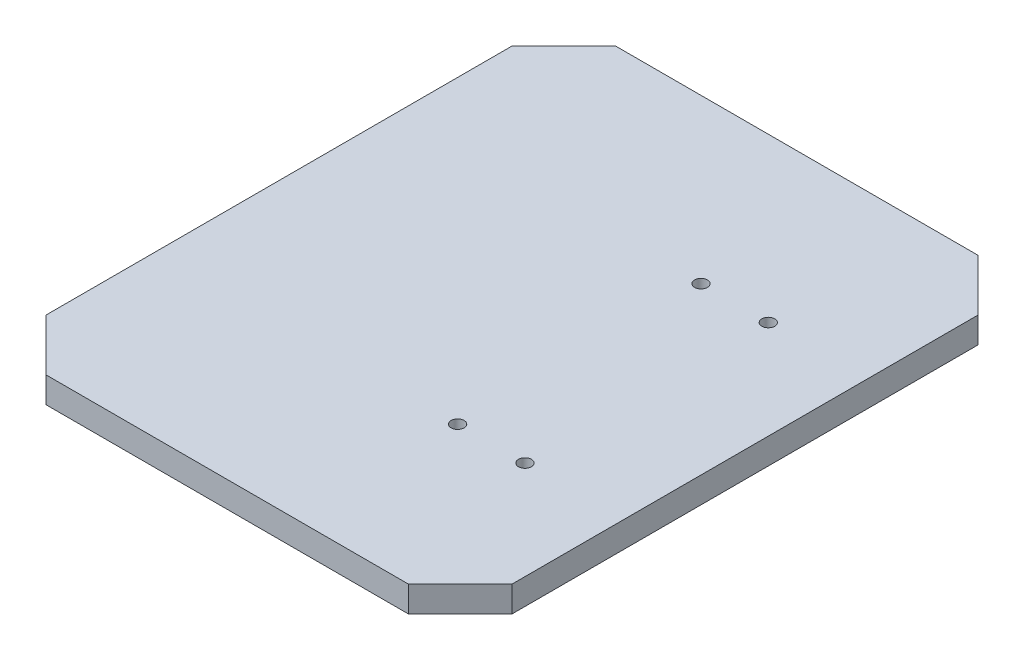
from build123d import *

# Parameters (mm, degrees)
SKETCH_1_W         = 90
SKETCH_1_H         = 110
EXTRUDE_1_DEPTH    = 5
CHAMFER_1_SIZE     = 10
HOLE_WIZARD_M3_1_D = 2.5


with BuildPart() as part:
    # 草图1 → 凸台-拉伸1 (new body)
    with BuildSketch(Plane(origin=(0, 0, 0), x_dir=(1, 0, 0), z_dir=(0, 1, 0))):
        with Locations((45, 55)):
            Rectangle(SKETCH_1_W, SKETCH_1_H)
    extrude(amount=EXTRUDE_1_DEPTH)

    # 倒角1
    chamfer_1_edges = [part.edges().sort_by_distance(p)[0] for p in [
        (0, 2.5, 0),
        (0, 2.5, -110),
        (90, 2.5, -110),
        (90, 2.5, 0),
    ]]
    chamfer(chamfer_1_edges, length=CHAMFER_1_SIZE)

    # M3 螺纹孔1 (through all)
    with Locations(Plane(origin=(0, 0, 0), x_dir=(-1, 0, 0), z_dir=(0, -1, 0))):
        with Locations((-58, 78.5), (-58, 31.5), (-71, 31.5), (-71, 78.5)):
            Hole(HOLE_WIZARD_M3_1_D / 2)


solid = part.part
